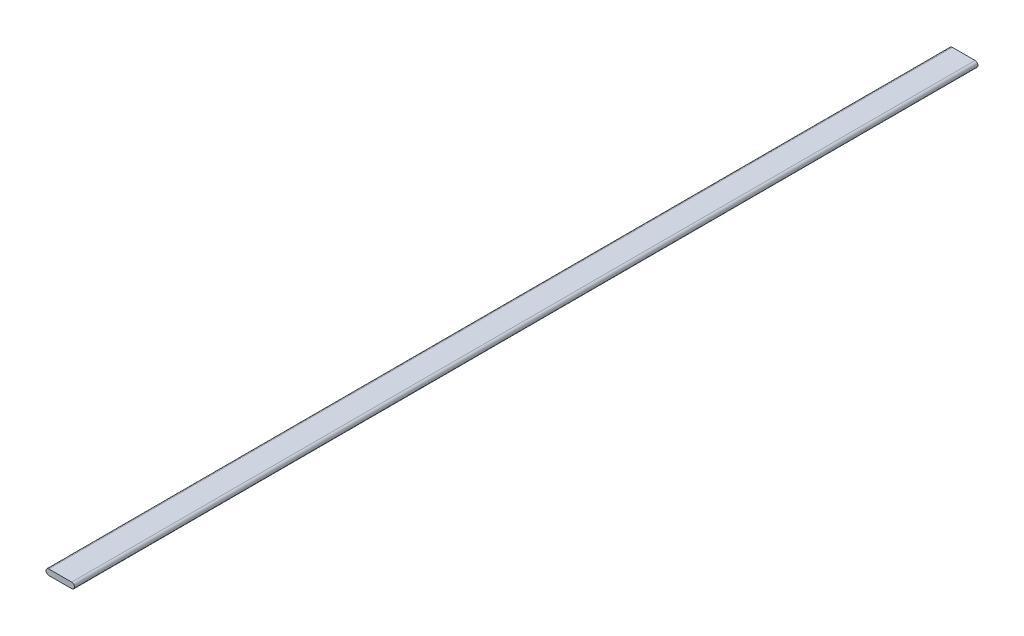
from build123d import *

# Parameters (mm, degrees)
BOSS_EXTRUDE1_DEPTH      = 40.259
BOSS_EXTRUDE1_DEPTH_BACK = 40.259


with BuildPart() as part:
    # Sketch2 → Boss-Extrude1 (new, two sides: drawn at the far end of the back side and taken through both)
    with BuildSketch(Plane.XY.offset(-BOSS_EXTRUDE1_DEPTH_BACK)):
        with BuildLine():
            Line((-1.016, -0.254), (1.016, -0.254))
            ThreePointArc((1.016, -0.254), (1.27, 0), (1.016, 0.254))
            Line((1.016, 0.254), (-1.016, 0.254))
            ThreePointArc((-1.016, 0.254), (-1.27, 0), (-1.016, -0.254))
        make_face()
    extrude(amount=BOSS_EXTRUDE1_DEPTH + BOSS_EXTRUDE1_DEPTH_BACK)


solid = part.part
